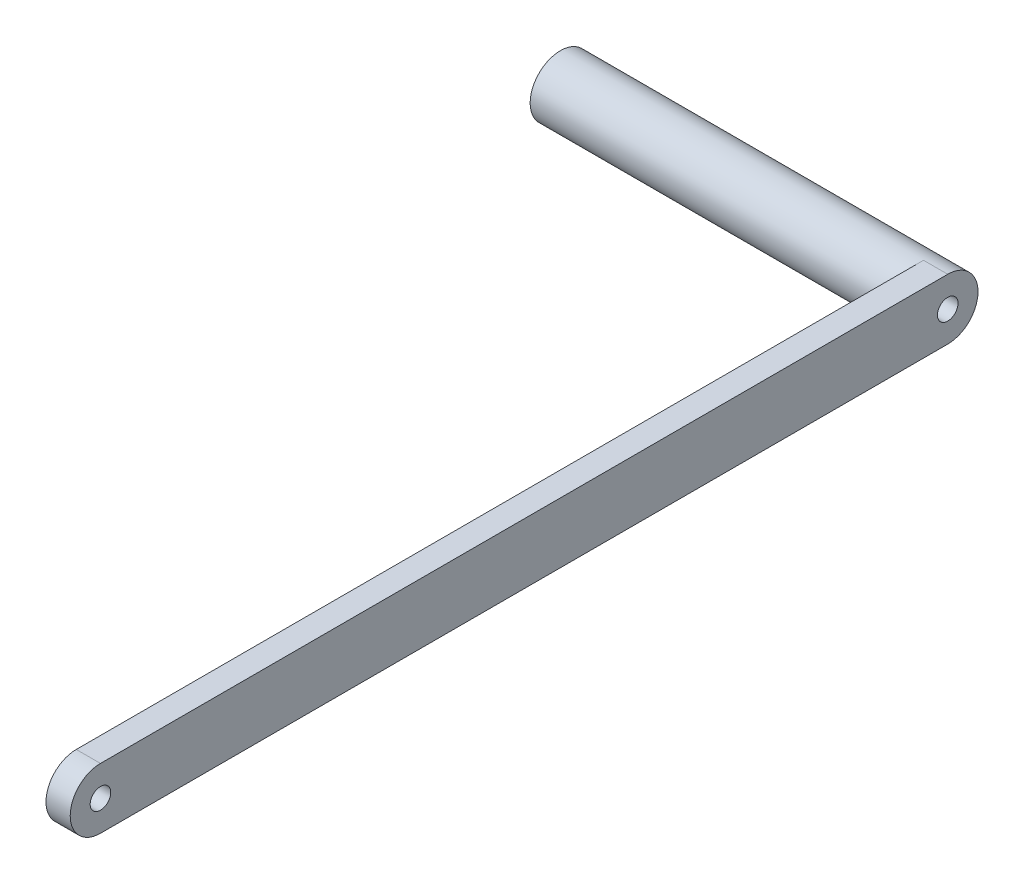
from build123d import *

# Parameters (mm, degrees)
RESSALTO_EXTRUS_O1_DEPTH = 2
RESSALTO_EXTRUS_O2_START = 30
ESBO_O2_R                = 2.5
RESSALTO_EXTRUS_O2_DEPTH = 30
CORTE_EXTRUS_O1_REACH    = 51.361
ESBO_O3_R                = 0.85
CORTE_EXTRUS_O2_REACH    = 50.088
ESBO_O4_R                = 0.85


with BuildPart() as part:
    # Esboço1 → Ressalto-extrusão1 (new body)
    with BuildSketch(Plane(origin=(0, 0, 0), x_dir=(0, 0, -1), z_dir=(1, 0, 0))):
        with BuildLine():
            Line((-35, 2.5), (35, 2.5))
            ThreePointArc((35, 2.5), (37.5, 0), (35, -2.5))
            Line((35, -2.5), (-35, -2.5))
            ThreePointArc((-35, -2.5), (-37.5, 0), (-35, 2.5))
        make_face()
    extrude(amount=RESSALTO_EXTRUS_O1_DEPTH)

    # Esboço2 → Ressalto-extrusão2 (add)
    with BuildSketch(Plane.ZY.offset(RESSALTO_EXTRUS_O2_START)):
        with Locations((-35, 0)):
            Circle(ESBO_O2_R)
    extrude(amount=-RESSALTO_EXTRUS_O2_DEPTH)

    # Esboço3 → Corte-extrusão1 (cut, up to next)
    with BuildSketch(Plane.ZY.offset(30), mode=Mode.PRIVATE) as corte_extrus_o1_sk1:
        with Locations((-35, 0)):
            Circle(ESBO_O3_R)
    corte_extrus_o1_tool1 = extrude(corte_extrus_o1_sk1.sketch, amount=-CORTE_EXTRUS_O1_REACH, mode=Mode.PRIVATE) & part.part
    add(corte_extrus_o1_tool1.solids().sort_by_distance((-30, 0, -35))[0], mode=Mode.SUBTRACT)

    # Esboço4 → Corte-extrusão2 (cut, up to next)
    with BuildSketch(Plane.ZY, mode=Mode.PRIVATE) as corte_extrus_o2_sk1:
        with Locations((35, 0)):
            Circle(ESBO_O4_R)
    corte_extrus_o2_tool1 = extrude(corte_extrus_o2_sk1.sketch, amount=-CORTE_EXTRUS_O2_REACH, mode=Mode.PRIVATE) & part.part
    add(corte_extrus_o2_tool1.solids().sort_by_distance((0, 0, 35))[0], mode=Mode.SUBTRACT)


solid = part.part
